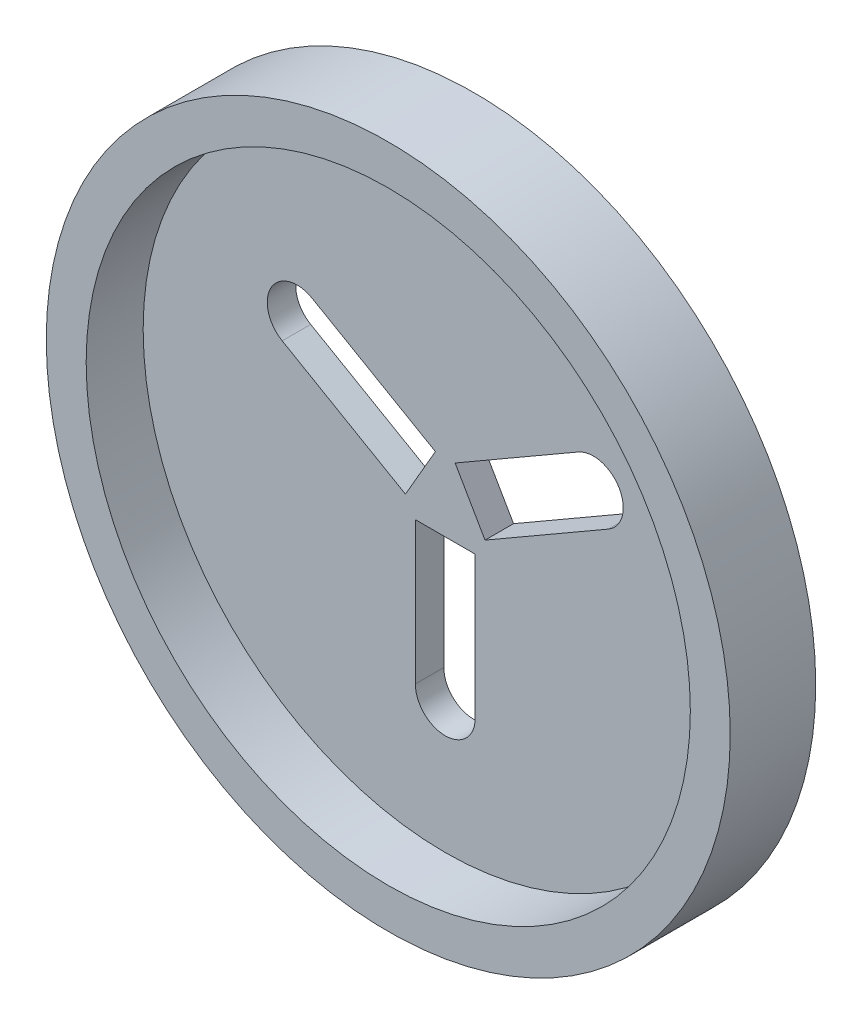
from build123d import *

# Parameters (mm, degrees)
CROQUIS1_R                   = 55
DISCO_DEPTH                  = 5
CORTAR_EXTRUIR1_DEPTH        = 10
SALIENTE_EXTRUIR1_DEPTH      = 10
SALIENTE_EXTRUIR1_DEPTH_BACK = 5
CROQUIS7_R                   = 60
CROQUIS7_R_2                 = 55
CROQUIS7_R_3                 = 53
SALIENTE_EXTRUIR6_DEPTH      = 5


with BuildPart() as part:
    # Croquis1 → Disco (new body)
    with BuildSketch(Plane.XY):
        Circle(CROQUIS1_R)
    extrude(amount=DISCO_DEPTH)

    # Croquis6 → Cortar-Extruir1 (cut)
    with BuildSketch(Plane.XY.offset(5)):
        with BuildLine():
            Line((-5.25, 0), (-5.25, -30))
            ThreePointArc((-5.25, -30), (0, -35.25), (5.25, -30))
            Line((5.25, -30), (5.25, 0))
            ThreePointArc((5.25, 0), (0, 5.25), (-5.25, 0))
        make_face()
        with BuildLine():
            Line((2.625, 4.54663337), (-23.355762114, 19.54663337))
            ThreePointArc((-23.355762114, 19.54663337), (-30.527395483, 17.625), (-28.605762114, 10.45336663))
            Line((-28.605762114, 10.45336663), (-2.625, -4.54663337))
            ThreePointArc((-2.625, -4.54663337), (4.54663337, -2.625), (2.625, 4.54663337))
        make_face()
        with BuildLine():
            Line((2.625, -4.54663337), (28.605762114, 10.45336663))
            ThreePointArc((28.605762114, 10.45336663), (30.527395483, 17.625), (23.355762114, 19.54663337))
            Line((23.355762114, 19.54663337), (-2.625, 4.54663337))
            ThreePointArc((-2.625, 4.54663337), (-4.54663337, -2.625), (2.625, -4.54663337))
        make_face()
    extrude(amount=-CORTAR_EXTRUIR1_DEPTH, mode=Mode.SUBTRACT)

    # Croquis7 → Saliente-Extruir1 (add, two sides: drawn at the far end of the back side and taken through both)
    # profile 1 of 2: a face of its own
    with BuildSketch(Plane.XY.offset(5).offset(-SALIENTE_EXTRUIR1_DEPTH_BACK)):
        Circle(CROQUIS7_R)
        Circle(CROQUIS7_R_2, mode=Mode.SUBTRACT)
    # profile 2 of 2: a face of its own
    with BuildSketch(Plane.XY.offset(5).offset(-SALIENTE_EXTRUIR1_DEPTH_BACK)):
        Circle(CROQUIS7_R_2)
        Circle(CROQUIS7_R_3, mode=Mode.SUBTRACT)
    extrude(amount=SALIENTE_EXTRUIR1_DEPTH + SALIENTE_EXTRUIR1_DEPTH_BACK)

    # Croquis8 → Saliente-Extruir6 (add)
    with BuildSketch(Plane.XY.offset(5)):
        Polygon((-8.714101615, -5.031088913), (0, 10.062177826), (8.714101615, -5.031088913), align=None)
    extrude(amount=-SALIENTE_EXTRUIR6_DEPTH)


solid = part.part
